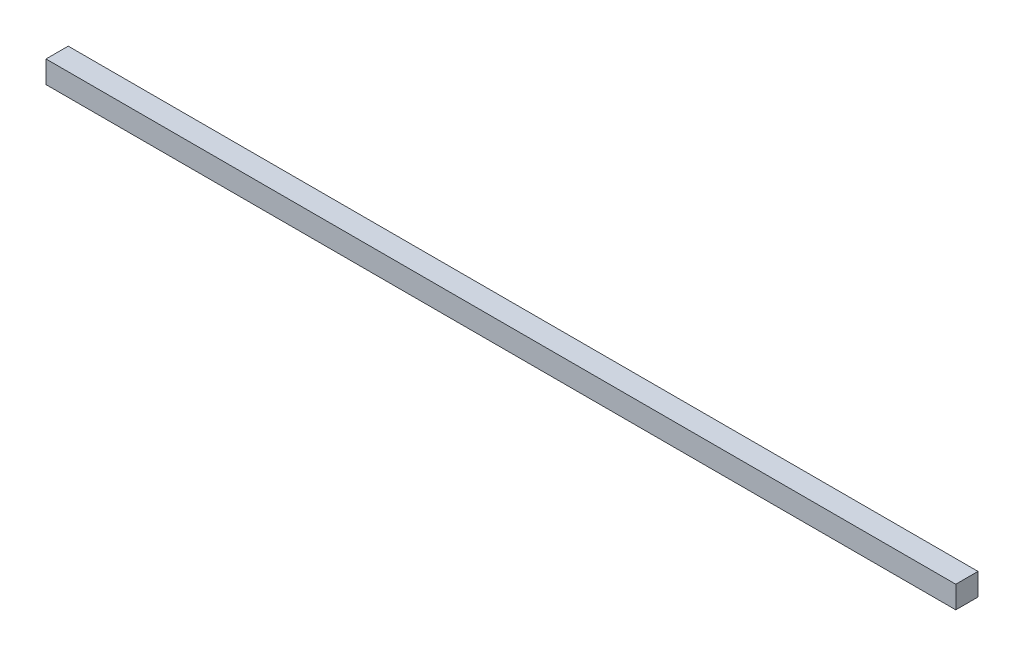
from build123d import *

# Parameters (mm, degrees)
BOSS_EXTRUDE1_DEPTH      = 65
BOSS_EXTRUDE1_DEPTH_BACK = 65
SKETCH3_W                = 3.175
SKETCH3_H                = 3.175


with BuildPart() as part:
    # Sketch3 → Boss-Extrude1 (new, two sides: drawn at the far end of the back side and taken through both)
    with BuildSketch(Plane(origin=(0, 0, 0), x_dir=(0, 0, -1), z_dir=(1, 0, 0)).offset(-BOSS_EXTRUDE1_DEPTH_BACK)):
        Rectangle(SKETCH3_W, SKETCH3_H)
    extrude(amount=BOSS_EXTRUDE1_DEPTH + BOSS_EXTRUDE1_DEPTH_BACK)


solid = part.part
